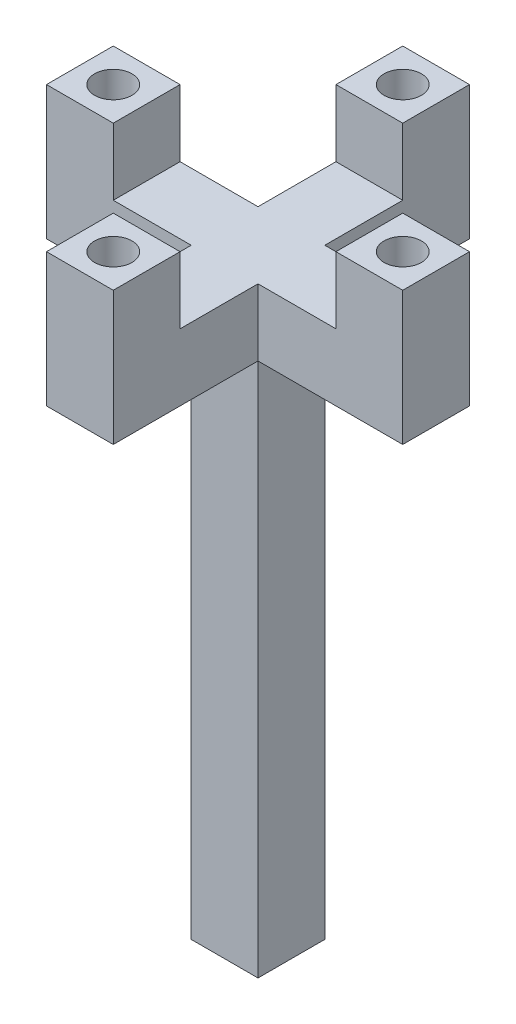
from build123d import *

# Parameters (mm, degrees)
BOSS_EXTRUDE1_DEPTH = 7.5
SKETCH3_R           = 2.1
CUT_EXTRUDE1_DEPTH  = 5
CIRPATTERN1_COUNT   = 2
CIRPATTERN1_ANGLE   = 90


with BuildPart() as part:
    # Sketch1 → Boss-Extrude1 (new body)
    with BuildSketch(Plane.XY):
        Polygon((12.5, 75), (20, 75), (20, 60), (3.75, 60), (3.75, 0), (-3.75, 0), (-3.75, 60), (-20, 60), (-20, 75), (-12.5, 75), (-12.5, 67.5), (0, 67.5), (12.5, 67.5), align=None)
    extrude(amount=BOSS_EXTRUDE1_DEPTH)

    # Sketch3 → Cut-Extrude1 (cut)
    with BuildSketch(Plane(origin=(0, 75, 0), x_dir=(1, 0, 0), z_dir=(0, 1, 0))):
        with Locations(Location((-16.25, -3.75, 0), (0, 0, 270))):
            Circle(SKETCH3_R)
        with Locations(Location((16.25, -3.75, 0), (0, 0, 270))):
            Circle(SKETCH3_R)
    extrude(amount=-CUT_EXTRUDE1_DEPTH, mode=Mode.SUBTRACT)


with BuildPart() as cirpattern1_1:
    # CirPattern1: pattern copy
    add(part.part.rotate(Axis((0, 0, 3.75), (0, -1, 0)), 1 * CIRPATTERN1_ANGLE / (CIRPATTERN1_COUNT - 1)))


with BuildPart() as part_1:
    add(part.part)

    # Combine1: union CirPattern1_1
    add(cirpattern1_1.part)


solid = part_1.part
